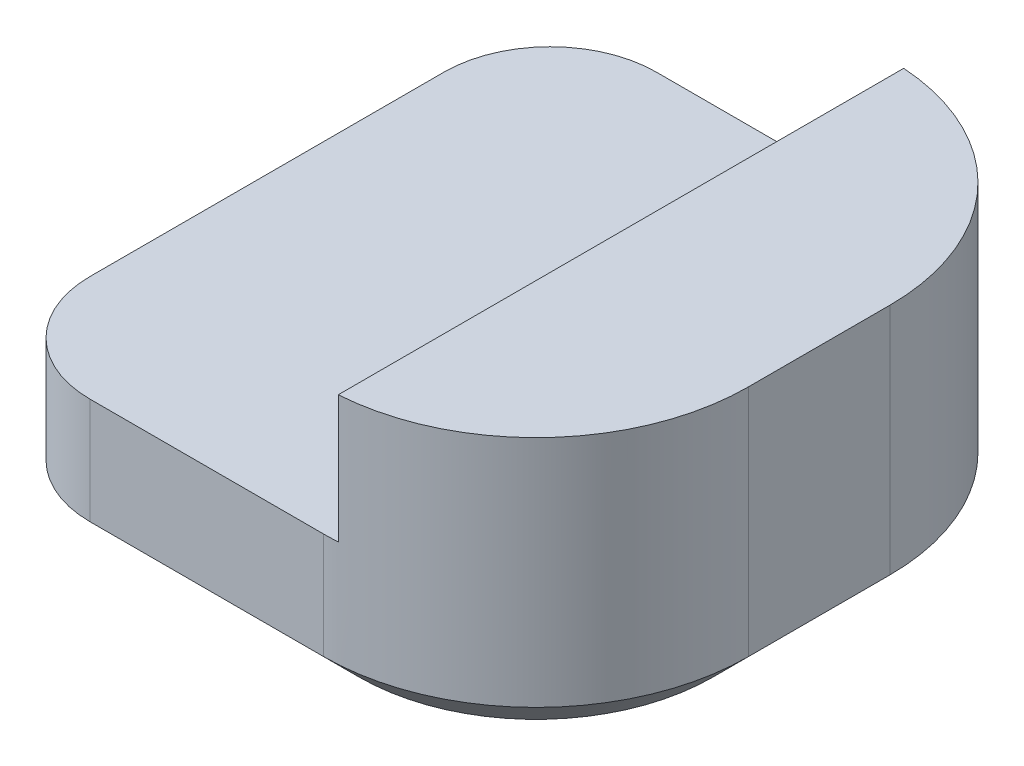
from build123d import *

# Parameters (mm, degrees)
BOSS_EXTRUDE1_DEPTH = 8
FILLET1_R           = 3
FILLET2_R           = 1.5
CHAMFER1_SIZE       = 0.5


with BuildPart() as part:
    # Sketch1 → Boss-Extrude1 (new body)
    with BuildSketch(Plane.XY):
        Polygon((0, 0), (5, 0), (5, 1.8), (7.8, 1.8), (7.8, 0), (7.8, -0.329113924), (7.8, -2), (6.430379747, -2), (0, -2), align=None)
    extrude(amount=BOSS_EXTRUDE1_DEPTH)

    # Fillet1
    fillet1_edges = [part.edges().sort_by_distance(p)[0] for p in [
        (7.8, -0.1, 0),
        (7.8, -0.1, 8),
    ]]
    fillet(fillet1_edges, radius=FILLET1_R)

    # Fillet2
    fillet2_edges = [part.edges().sort_by_distance(p)[0] for p in [
        (0, -1, 0),
        (0, -1, 8),
    ]]
    fillet(fillet2_edges, radius=FILLET2_R)

    # Chamfer1
    chamfer1_edges = [part.edges().sort_by_distance(p)[0] for p in [
        (7.8, -2, 4),
        (6.921320344, -2, 7.121320344),
        (6.921320344, -2, 0.878679656),
        (0, -2, 4),
        (3.15, -2, 0),
        (3.15, -2, 8),
        (0.439339828, -2, 7.560660172),
        (0.439339828, -2, 0.439339828),
    ]]
    chamfer(chamfer1_edges, length=CHAMFER1_SIZE)


solid = part.part
